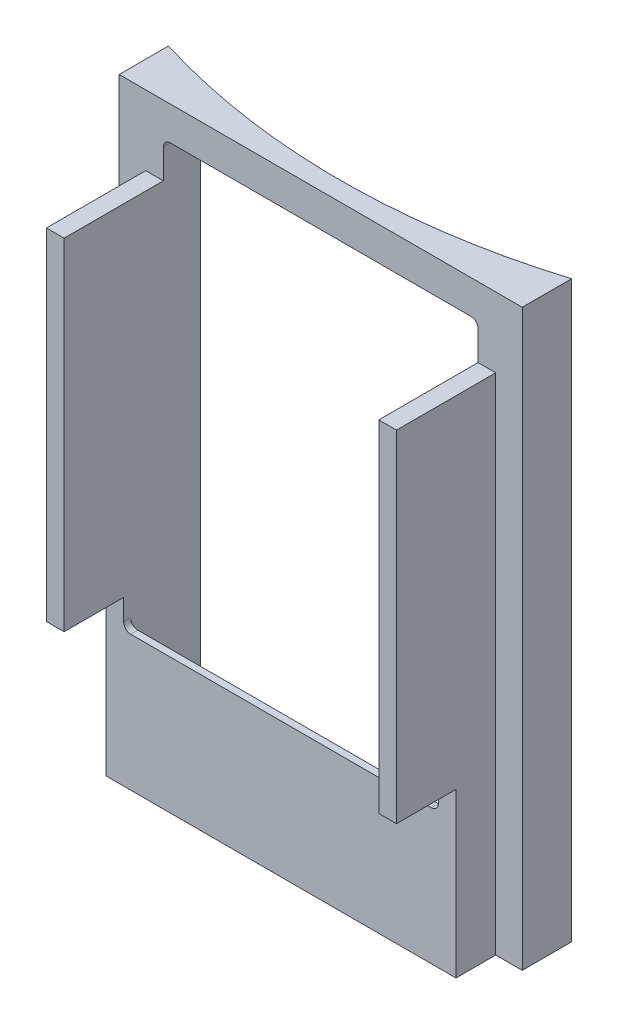
from build123d import *

# Parameters (mm, degrees)
SKETCH1_W           = 144.78
SKETCH1_H           = 206.248
EXTRUDE1_DEPTH      = 252.4252
SKETCH7_W           = 125.73
SKETCH7_H           = 196.723
EXTRUDE5_DEPTH      = 35.64418
EXTRUDE2_DEPTH      = 42.08
EXTRUDE2_DEPTH_BACK = 273.8502
SKETCH4_W           = 113.03
SKETCH4_H           = 142.748
SKETCH10_W          = 113.03
SKETCH10_H          = 2.921
SKETCH10_H_2        = 45.974
EXTRUDE8_DEPTH      = 264.16
SKETCH11_W          = 113.03
SKETCH11_H          = 2.921
EXTRUDE9_DEPTH      = 21.59
FILLET1_R           = 2.54
SKETCH2_R           = 245.618
EXTRUDE4_DEPTH      = 230
SKETCH12_W          = 125.73
SKETCH12_H          = 43.053
EXTRUDE10_DEPTH     = 21.36938
SKETCH14_W          = 132.74265683
SKETCH14_H          = 39.732066683
CUT_EXTRUDE1_DEPTH  = 15.623999994
SKETCH15_W          = 144.34776975
SKETCH15_H          = 23.27915683
CUT_EXTRUDE2_DEPTH  = 15.623999994


with BuildPart() as part:
    # Sketch1 → Extrude1 (new body)
    with BuildSketch(Plane.XY):
        with Locations((25.4, -16.764)):
            Rectangle(SKETCH1_W, SKETCH1_H)
    extrude(amount=EXTRUDE1_DEPTH)

    # Sketch7 → Extrude5 (add)
    with BuildSketch(Plane.XY.offset(252.4252)):
        with Locations((25.4, -21.5265)):
            Rectangle(SKETCH7_W, SKETCH7_H)
    extrude(amount=EXTRUDE5_DEPTH)

    # Sketch4 → Extrude2 (cut, two sides: drawn at the far end of the back side and taken through both)
    with BuildSketch(Plane.XY.offset(252.4252).offset(-EXTRUDE2_DEPTH_BACK)):
        with Locations((25.4, 0)):
            Rectangle(SKETCH4_W, SKETCH4_H)
    extrude(amount=EXTRUDE2_DEPTH + EXTRUDE2_DEPTH_BACK, mode=Mode.SUBTRACT)

    # Sketch10 → Extrude8 (cut)
    with BuildSketch(Plane(origin=(0, 0, 0), x_dir=(-1, 0, 0), z_dir=(0, 0, -1))):
        with Locations((-25.4, 72.8345)):
            Rectangle(SKETCH10_W, SKETCH10_H)
        with Locations((-25.4, -94.361)):
            Rectangle(SKETCH10_W, SKETCH10_H_2)
    extrude(amount=-EXTRUDE8_DEPTH, mode=Mode.SUBTRACT)

    # Sketch11 → Extrude9 (cut)
    with BuildSketch(Plane(origin=(0, 0, 264.16), x_dir=(-1, 0, 0), z_dir=(0, 0, -1))):
        with Locations((-25.4, 72.8345)):
            Rectangle(SKETCH11_W, SKETCH11_H)
    extrude(amount=-EXTRUDE9_DEPTH, mode=Mode.SUBTRACT)

    # Fillet1
    fillet1_edges = [part.edges().sort_by_distance(p)[0] for p in [
        (-31.115, 71.374, 286.90969),
        (-31.115, -71.374, 276.11469),
        (81.915, -71.374, 276.11469),
        (81.915, 71.374, 286.90969),
        (81.915, 74.295, 142.875),
        (-31.115, 74.295, 142.875),
        (81.915, -117.348, 132.08),
        (-31.115, -117.348, 132.08),
    ]]
    fillet(fillet1_edges, radius=FILLET1_R)

    # Sketch2 → Extrude4 (cut)
    with BuildSketch(Plane(origin=(0, 86.36, 0), x_dir=(-1, 0, 0), z_dir=(0, 1, 0))):
        with Locations((-25.4, 0)):
            Circle(SKETCH2_R)
    extrude(amount=-EXTRUDE4_DEPTH, mode=Mode.SUBTRACT)

    # Sketch12 → Extrude10 (cut)
    with BuildSketch(Plane.XY.offset(288.06938)):
        with Locations((25.4, -98.3615)):
            Rectangle(SKETCH12_W, SKETCH12_H)
    extrude(amount=-EXTRUDE10_DEPTH, mode=Mode.SUBTRACT)

    # Sketch14 → Cut-Extrude1 (cut)
    with BuildSketch(Plane(origin=(0, 76.835, 0), x_dir=(1, 0, 0), z_dir=(0, 1, 0))):
        with Locations((21.893671585, -272.291233342)):
            Rectangle(SKETCH14_W, SKETCH14_H)
    extrude(amount=-CUT_EXTRUDE1_DEPTH, mode=Mode.SUBTRACT)

    # Sketch15 → Cut-Extrude2 (cut)
    with BuildSketch(Plane.XZ.offset(76.835)):
        with Locations((25.85194999, 278.339578415)):
            Rectangle(SKETCH15_W, SKETCH15_H)
    extrude(amount=-CUT_EXTRUDE2_DEPTH, mode=Mode.SUBTRACT)


solid = part.part
